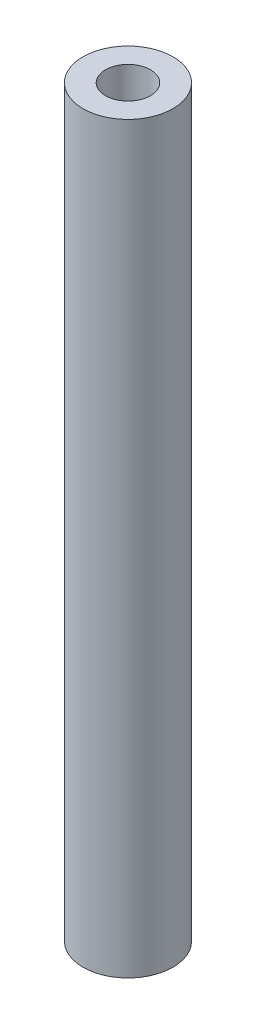
from build123d import *

# Parameters (mm, degrees)
SKETCH1_R           = 3.75
SKETCH1_R_2         = 1.875
BOSS_EXTRUDE1_DEPTH = 62


with BuildPart() as part:
    # Sketch1 → Boss-Extrude1 (new body)
    with BuildSketch(Plane(origin=(0, 0, 0), x_dir=(1, 0, 0), z_dir=(0, 1, 0))):
        with Locations(Location((0, 0, 0), (0, 0, 270))):
            Circle(SKETCH1_R)
        with Locations(Location((0, 0, 0), (0, 0, 270))):
            Circle(SKETCH1_R_2, mode=Mode.SUBTRACT)
    extrude(amount=BOSS_EXTRUDE1_DEPTH)


solid = part.part
